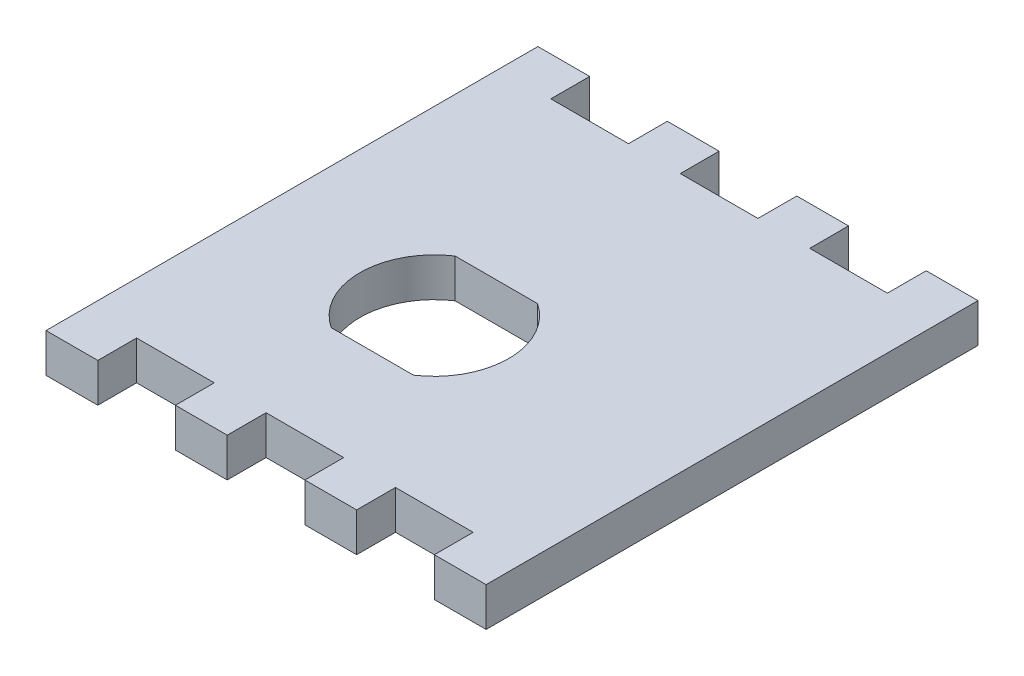
from build123d import *

# Parameters (mm, degrees)
SKETCH1_W            = 34
SKETCH1_H            = 38
BOSS_EXTRUDE1_DEPTH  = 3
SKETCH3_W            = 6
SKETCH3_H            = 3
CUT_EXTRUDE2_DEPTH   = 3
LPATTERN2_COUNT      = 3
LPATTERN2_PITCH      = 10
LPATTERN2_COUNT_DIR2 = 2
LPATTERN2_PITCH_DIR2 = 35
CUT_EXTRUDE4_DEPTH   = 3


with BuildPart() as part:
    # Sketch1 → Boss-Extrude1 (new body)
    with BuildSketch(Plane(origin=(0, 0, 0), x_dir=(1, 0, 0), z_dir=(0, 1, 0))):
        Rectangle(SKETCH1_W, SKETCH1_H)
    extrude(amount=BOSS_EXTRUDE1_DEPTH)

    # Sketch3 → Cut-Extrude2 (cut)
    with BuildSketch(Plane(origin=(0, 3, 0), x_dir=(1, 0, 0), z_dir=(0, 1, 0))):
        with Locations((-10, 17.5)):
            Rectangle(SKETCH3_W, SKETCH3_H)
    cut_extrude2 = extrude(amount=-CUT_EXTRUDE2_DEPTH, mode=Mode.SUBTRACT)

    # LPattern2: Cut-Extrude2 3 × 2
    with Locations(*[(i * LPATTERN2_PITCH, 0, j * LPATTERN2_PITCH_DIR2) for i in range(LPATTERN2_COUNT) for j in range(LPATTERN2_COUNT_DIR2) if (i, j) != (0, 0)]):
        add(cut_extrude2, mode=Mode.SUBTRACT)

    # Sketch4 → Cut-Extrude4 (cut)
    with BuildSketch(Plane(origin=(0, 3, 0), x_dir=(1, 0, 0), z_dir=(0, 1, 0))):
        with BuildLine():
            Line((-6.178432091, -7.791666667), (0.178432091, -7.791666667))
            ThreePointArc((0.178432091, -7.791666667), (2.74999925, -3.002936198), (0.183324096, 1.788418079))
            Line((0.183324096, 1.788418079), (-6.183324096, 1.788418079))
            ThreePointArc((-6.183324096, 1.788418079), (-8.74999925, -3.002936198), (-6.178432091, -7.791666667))
        make_face()
    extrude(amount=-CUT_EXTRUDE4_DEPTH, mode=Mode.SUBTRACT)


solid = part.part
